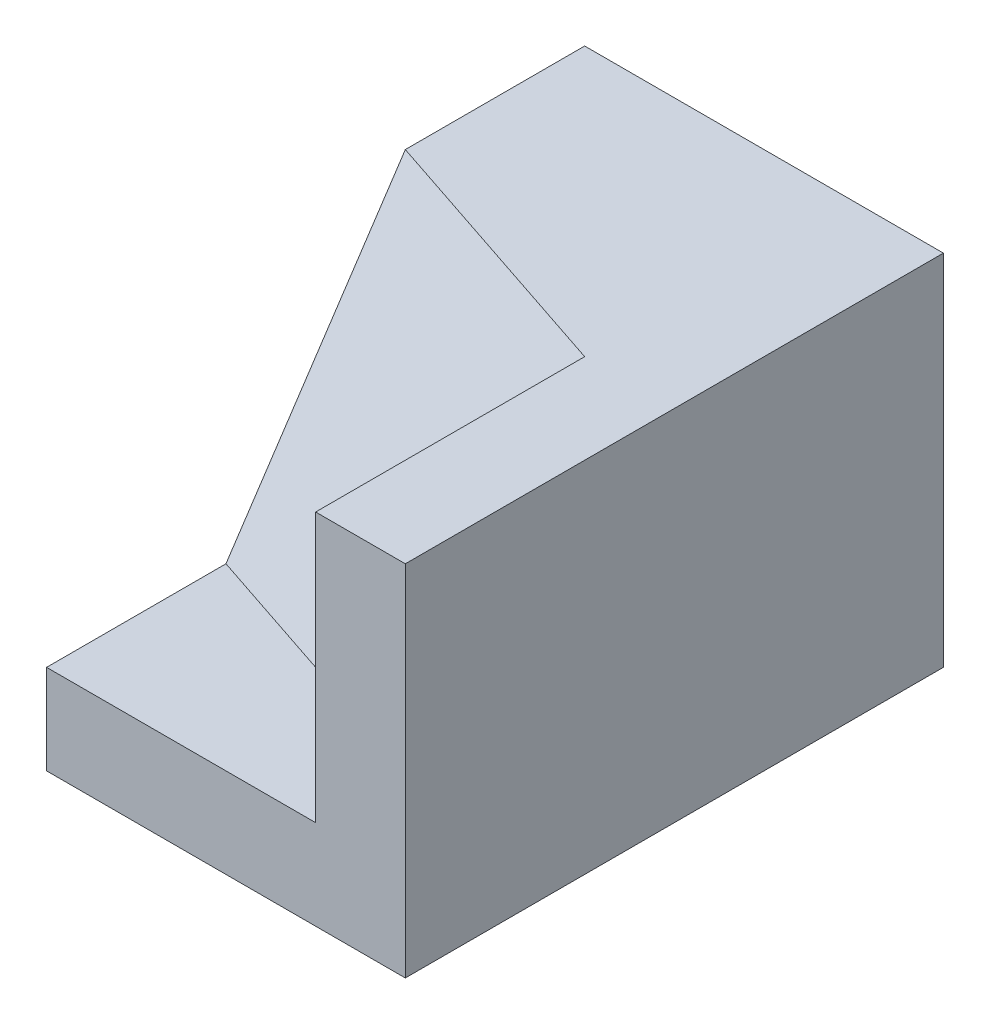
from build123d import *

# Parameters (mm, degrees)
SKETCH_10_W         = 60
SKETCH_10_H         = 40
EXTRUDE_3_DEPTH     = 40
CUT_EXTRUDE_2_DEPTH = 30


with BuildPart() as part:
    # 草圖10 → 填料-伸長3 (new body)
    with BuildSketch(Plane(origin=(0, 0, 0), x_dir=(0, 0, -1), z_dir=(1, 0, 0))):
        with Locations((-2.876712329, 15.643835616)):
            Rectangle(SKETCH_10_W, SKETCH_10_H)
    extrude(amount=EXTRUDE_3_DEPTH)

    # 草圖11 → 除料-伸長2 (cut)
    with BuildSketch(Plane(origin=(0, 35.643835616, 0), x_dir=(1, 0, 0), z_dir=(0, 1, 0))):
        Polygon((0, -12.876712329), (30, -22.876712329), (30, -32.876712329), (0, -32.876712329), align=None)
    extrude(amount=-CUT_EXTRUDE_2_DEPTH, mode=Mode.SUBTRACT)

    # 除料-掃出1: sweep along a path in 草圖13
    with BuildLine(Plane(origin=(0, 5.643835616, 0), x_dir=(1, 0, 0), z_dir=(0, 1, 0))) as sweep_1_path:
        Line((30, -22.876712329), (0, -12.876712329))
    # 草圖12 → 除料-掃出1 (sweep, cut)
    with BuildSketch(Plane.ZY.offset(-30)):
        Polygon((22.876712329, 5.643835616), (2.876712329, 35.643835616), (32.876712329, 35.643835616), (32.876712329, 5.643835616), align=None)
    sweep(path=sweep_1_path.line, mode=Mode.SUBTRACT)


solid = part.part
